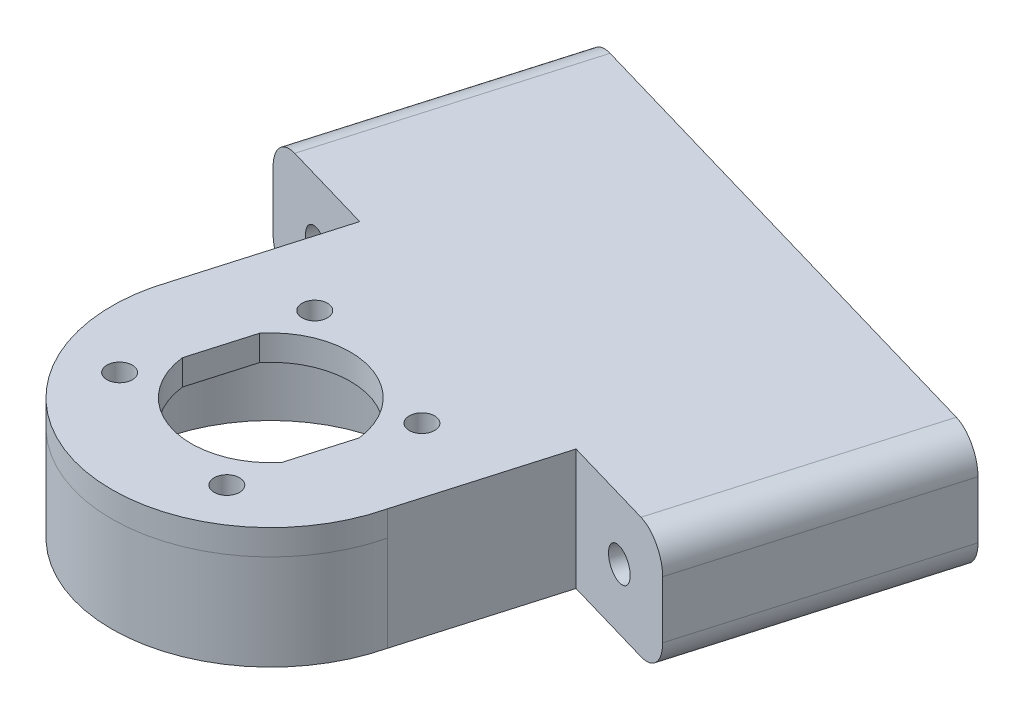
from build123d import *

# Parameters (mm, degrees)
SKETCH1_R           = 25.000000000000004
SKETCH1_R_2         = 1.9999999999993712
SKETCH1_R_3         = 2.0000000000000036
SKETCH1_R_4         = 2.0000000000002736
SKETCH1_R_5         = 1.9999999999996778
BOSS_EXTRUDE1_DEPTH = 4
SKETCH2_R           = 25
SKETCH2_R_2         = 22.50000000000001
BOSS_EXTRUDE2_DEPTH = 15
BOSS_EXTRUDE7_REACH = 78.843
SKETCH4_W           = 49.955357531530346
SKETCH4_H           = 19
BOSS_EXTRUDE8_DEPTH = 40
SKETCH7_R           = 2.499999999999995
SKETCH7_R_2         = 2.5000000000000004
CUT_EXTRUDE1_DEPTH  = 123.01861707374391
FILLET1_R           = 5
FILLET2_R           = 5


with BuildPart() as part:
    # Sketch1 → Boss-Extrude1 (new body)
    with BuildSketch(Plane(origin=(0, 0, 0), x_dir=(1, 0, 0), z_dir=(0, 1, 0))):
        with Locations(Location((21.22072875619714, -40.09390888269783, 0), (0, 0, 270))):
            Circle(SKETCH1_R)
        with Locations(Location((29.646509797315062, -55.43197309716617, 0), (0, 0, 270))):
            Circle(SKETCH1_R_2, mode=Mode.SUBTRACT)
        with Locations(Location((36.558792970665294, -31.668127841580553, 0), (0, 0, 270))):
            Circle(SKETCH1_R_3, mode=Mode.SUBTRACT)
        with Locations(Location((12.794947715079665, -24.75584466823032, 0), (0, 0, 270))):
            Circle(SKETCH1_R_4, mode=Mode.SUBTRACT)
        with Locations(Location((5.8826645417294365, -48.51968992381595, 0), (0, 0, 270))):
            Circle(SKETCH1_R_5, mode=Mode.SUBTRACT)
        with BuildLine():
            ThreePointArc((8.810101512256844, -41.5859984952772), (17.729498538084204, -52.096463259335145), (30.894801565269475, -48.009862096604984))
            Line((30.894801565269475, -48.009862096604984), (33.63135600013741, -38.60181927011846))
            ThreePointArc((33.63135600013741, -38.60181927011846), (24.711958974310075, -28.091354506060547), (11.5466559471248, -32.177955668790645))
            Line((11.5466559471248, -32.177955668790645), (8.810101512256844, -41.5859984952772))
        make_face(mode=Mode.SUBTRACT)
    extrude(amount=BOSS_EXTRUDE1_DEPTH)

    # Sketch2 → Boss-Extrude2 (add)
    with BuildSketch(Plane.XZ):
        with Locations(Location((21.22070938805554, 40.093908619998004, 0), (0, 0, 270.77710591))):
            Circle(SKETCH2_R)
        with Locations(Location((21.22070938805554, 40.093908619998004, 0), (0, 0, 270))):
            Circle(SKETCH2_R_2, mode=Mode.SUBTRACT)
    extrude(amount=BOSS_EXTRUDE2_DEPTH)

    # Sketch4 → Boss-Extrude7 (add, up to next)
    with BuildSketch(Plane(origin=(-2.11468835096776, 0, 7.270119796296657), x_dir=(-0.9602043501309836, 0, -0.2792984174490354), z_dir=(0.2792984174490354, 0, -0.9602043501309836)), mode=Mode.PRIVATE) as boss_extrude7_sk1:
        with Locations((-31.573501878114026, -5.500000000000001)):
            Rectangle(SKETCH4_W, SKETCH4_H)
    boss_extrude7_tool1 = extrude(boss_extrude7_sk1.sketch, amount=-BOSS_EXTRUDE7_REACH, mode=Mode.PRIVATE) - part.part
    add(boss_extrude7_tool1.solids().sort_by_distance((28.202326, -5.5, 16.088549))[0])

    # Sketch5 → Boss-Extrude8 (add)
    with BuildSketch(Plane(origin=(-2.114688350967763, 0, 7.270119796296668), x_dir=(-0.9602043501309836, 0, -0.27929841744903544), z_dir=(0.27929841744903544, 0, -0.9602043501309836))):
        Polygon((13.404176887651147, 4), (-76.55118064387919, 4), (-76.55118064387919, -15), (13.404176887651147, -15), (13.404176887651147, -5.5), align=None)
    extrude(amount=BOSS_EXTRUDE8_DEPTH)

    # Sketch7 → Cut-Extrude1 (cut, through all)
    with BuildSketch(Plane(origin=(9.057248346993656, 1.8e-15, -31.13805420894269), x_dir=(-0.9602043501309836, 0, -0.27929841744903544), z_dir=(0.27929841744903544, 0, -0.9602043501309836))):
        with Locations((-66.55118064387919, -5.499999999999998)):
            Circle(SKETCH7_R)
        with Locations((3.4041768876511456, -5.499999999999997)):
            Circle(SKETCH7_R_2)
    extrude(amount=-CUT_EXTRUDE1_DEPTH, mode=Mode.SUBTRACT)

    # Fillet1
    fillet1_edges = [part.edges().sort_by_distance(p)[0] for p in [
        (76.9760566599285, -15, 9.446656401367687),
    ]]
    fillet(fillet1_edges, radius=FILLET1_R)

    # Fillet2
    fillet2_edges = [part.edges().sort_by_distance(p)[0] for p in [
        (-9.399468959434873, -15, -15.677732598250907),
        (-9.399468959434873, 4, -15.677732598250907),
        (76.9760566599285, 4, 9.446656401367687),
    ]]
    fillet(fillet2_edges, radius=FILLET2_R)


solid = part.part
